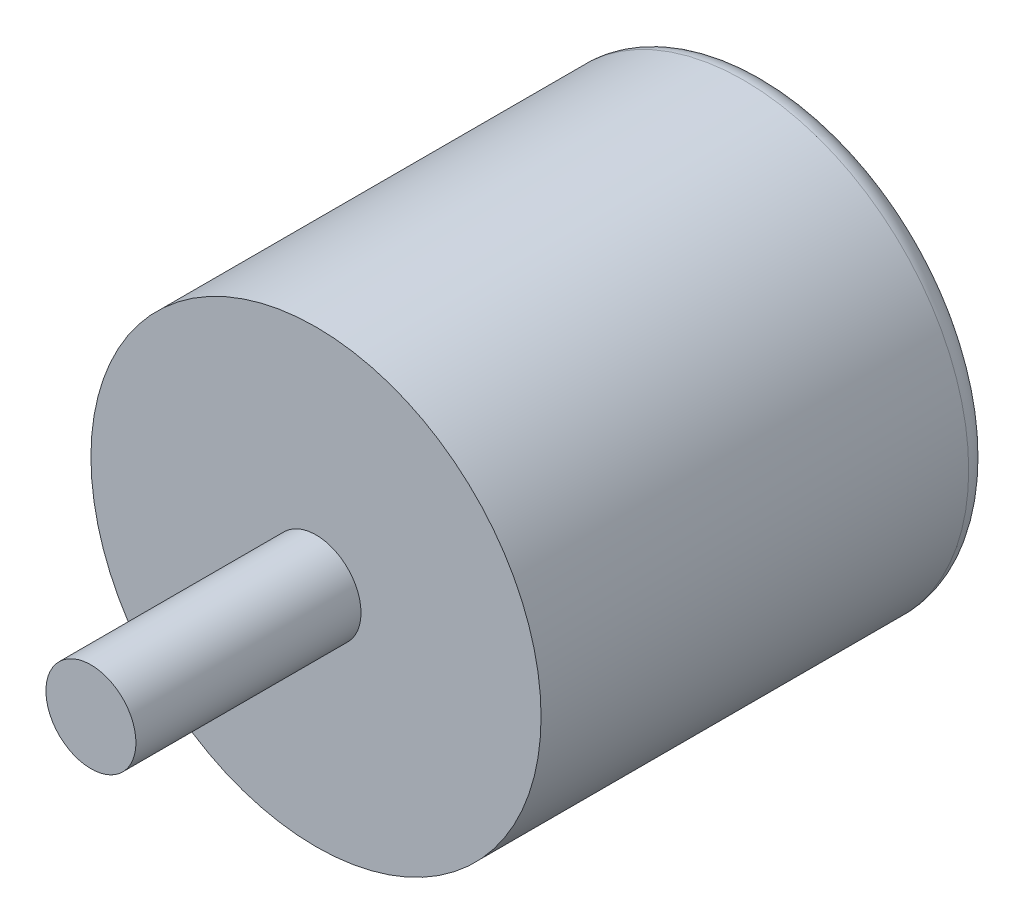
from build123d import *

# Parameters (mm, degrees)
SKETCH1_R           = 12.7
BOSS_EXTRUDE1_DEPTH = 25.4
SKETCH2_R           = 2.54
BOSS_EXTRUDE2_DEPTH = 12.7
FILLET1_R           = 1.27


with BuildPart() as part:
    # Sketch1 → Boss-Extrude1 (new body)
    with BuildSketch(Plane.XY):
        Circle(SKETCH1_R)
    extrude(amount=BOSS_EXTRUDE1_DEPTH)

    # Sketch2 → Boss-Extrude2 (add)
    with BuildSketch(Plane.XY.offset(25.4)):
        Circle(SKETCH2_R)
    extrude(amount=BOSS_EXTRUDE2_DEPTH)

    # Fillet1
    fillet1_edges = [part.edges().sort_by_distance(p)[0] for p in [
        (-12.7, 0, 0),
    ]]
    fillet(fillet1_edges, radius=FILLET1_R)


solid = part.part
